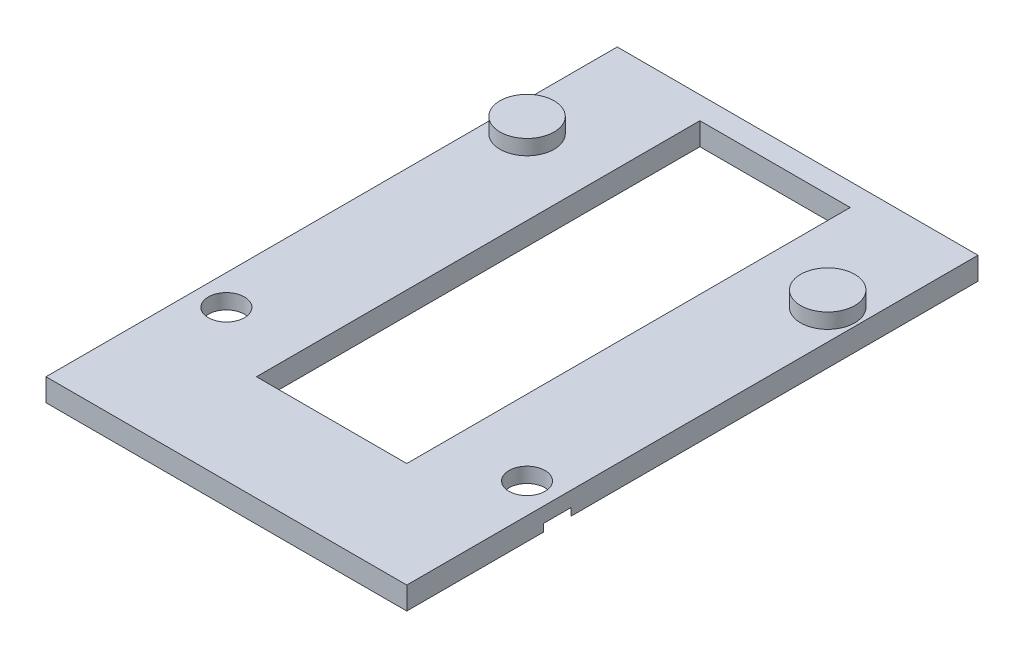
from build123d import *

# Parameters (mm, degrees)
ESQUISSE1_W           = 24
ESQUISSE1_H           = 38
ESQUISSE1_W_2         = 10
ESQUISSE1_H_2         = 29.5
SHAPE_DEPTH           = 1.5
ESQUISSE2_R           = 1.2
VISHOLES_DEPTH        = 1.5
ESQUISSE3_R           = 1.8
LOCKERS_DEPTH         = 1
ESQUISSE4_R           = 2.2
SCREWHATREMOVER_DEPTH = 0.5


with BuildPart() as part:
    # Esquisse1 → Shape (new body)
    with BuildSketch(Plane(origin=(0, 0, 0), x_dir=(1, 0, 0), z_dir=(0, 1, 0))):
        Rectangle(ESQUISSE1_W, ESQUISSE1_H)
        with Locations((0, 2.75)):
            Rectangle(ESQUISSE1_W_2, ESQUISSE1_H_2, mode=Mode.SUBTRACT)
    extrude(amount=SHAPE_DEPTH)

    # Esquisse2 → VisHoles (cut)
    with BuildSketch(Plane(origin=(0, 1.5, 0), x_dir=(1, 0, 0), z_dir=(0, 1, 0))):
        with Locations(Location((10, -9, 0), (0, 0, 270))):
            Circle(ESQUISSE2_R)
    visholes = extrude(amount=-VISHOLES_DEPTH, mode=Mode.SUBTRACT)

    # Esquisse3 → Lockers (add)
    with BuildSketch(Plane(origin=(0, 1.5, 0), x_dir=(1, 0, 0), z_dir=(0, 1, 0))):
        with Locations(Location((10, 11, 0), (0, 0, 90))):
            Circle(ESQUISSE3_R)
    lockers = extrude(amount=LOCKERS_DEPTH)

    # Esquisse4 → ScrewHatRemover (cut)
    with BuildSketch(Plane(origin=(0, 0, 0), x_dir=(1, 0, 0), z_dir=(0, 1, 0))):
        with Locations((10, -9)):
            Circle(ESQUISSE4_R)
    screwhatremover = extrude(amount=SCREWHATREMOVER_DEPTH, mode=Mode.SUBTRACT)

    # Symétrie1: VisHoles, Lockers, ScrewHatRemover across plane
    add(visholes.mirror(Plane(origin=(0, 0, 0), x_dir=(0, 0, 1), z_dir=(1, 0, 0))), mode=Mode.SUBTRACT)
    add(lockers.mirror(Plane(origin=(0, 0, 0), x_dir=(0, 0, 1), z_dir=(1, 0, 0))))
    add(screwhatremover.mirror(Plane(origin=(0, 0, 0), x_dir=(0, 0, 1), z_dir=(1, 0, 0))), mode=Mode.SUBTRACT)


solid = part.part
